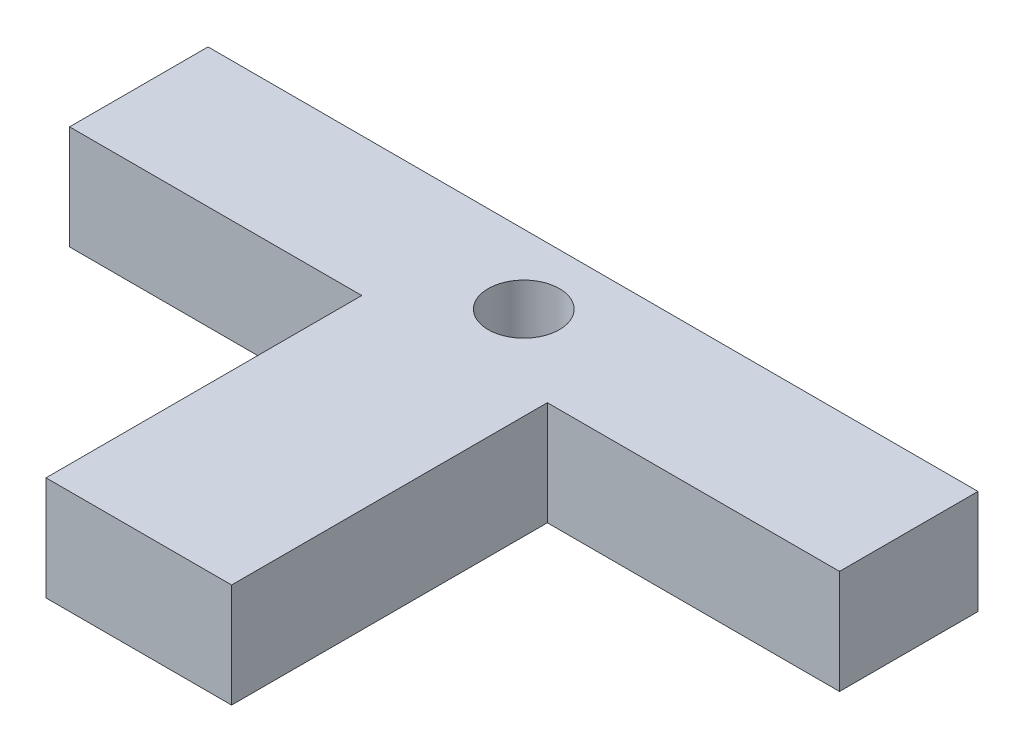
from build123d import *

# Parameters (mm, degrees)
SKETCH2_W           = 111
SKETCH2_H           = 19.962120642
SKETCH2_R           = 5.135
SKETCH2_W_2         = 26.757359312
SKETCH2_H_2         = 45.518939679
BOSS_EXTRUDE1_DEPTH = 15


with BuildPart() as part:
    # Sketch2 → Boss-Extrude1 (new body)
    # profile 1 of 2: a face of its own
    with BuildSketch(Plane(origin=(0, 0, 0), x_dir=(1, 0, 0), z_dir=(0, 1, 0))):
        Rectangle(SKETCH2_W, SKETCH2_H)
        with Locations(Location((0, 0, 0), (0, 0, 270))):
            Circle(SKETCH2_R, mode=Mode.SUBTRACT)
    # profile 2 of 2: a face of its own
    with BuildSketch(Plane(origin=(0, 0, 0), x_dir=(1, 0, 0), z_dir=(0, 1, 0))):
        with Locations((0, -32.740530161)):
            Rectangle(SKETCH2_W_2, SKETCH2_H_2)
    extrude(amount=BOSS_EXTRUDE1_DEPTH)


solid = part.part
